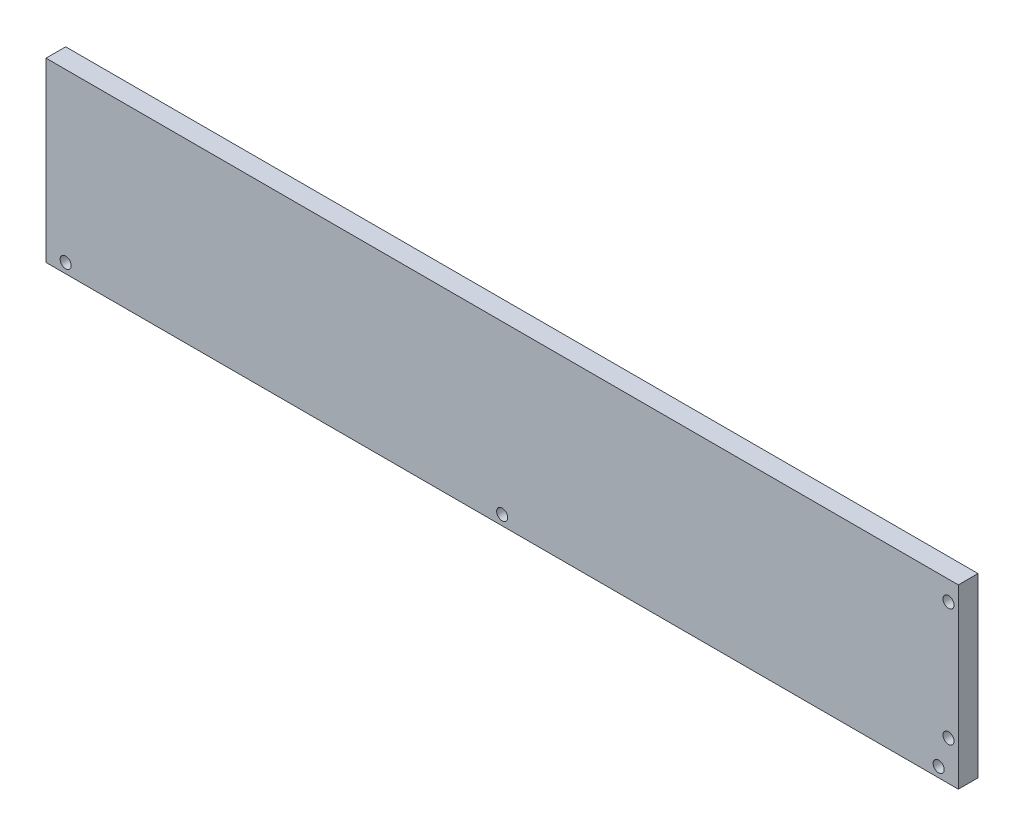
from build123d import *

# Parameters (mm, degrees)
SKETCH1_W           = 294.64
SKETCH1_H           = 57.15
SKETCH1_R           = 1.7859375
BOSS_EXTRUDE1_DEPTH = 6.35


with BuildPart() as part:
    # Sketch1 → Boss-Extrude1 (new body)
    with BuildSketch(Plane.XY):
        with Locations((147.32, 28.575)):
            Rectangle(SKETCH1_W, SKETCH1_H)
        with Locations((6.35, 3.175)):
            Circle(SKETCH1_R, mode=Mode.SUBTRACT)
        with Locations((147.32, 3.175)):
            Circle(SKETCH1_R, mode=Mode.SUBTRACT)
        with Locations((288.29, 3.175)):
            Circle(SKETCH1_R, mode=Mode.SUBTRACT)
        with Locations((291.465, 50.8)):
            Circle(SKETCH1_R, mode=Mode.SUBTRACT)
        with Locations((291.465, 12.7)):
            Circle(SKETCH1_R, mode=Mode.SUBTRACT)
    extrude(amount=BOSS_EXTRUDE1_DEPTH)


solid = part.part
